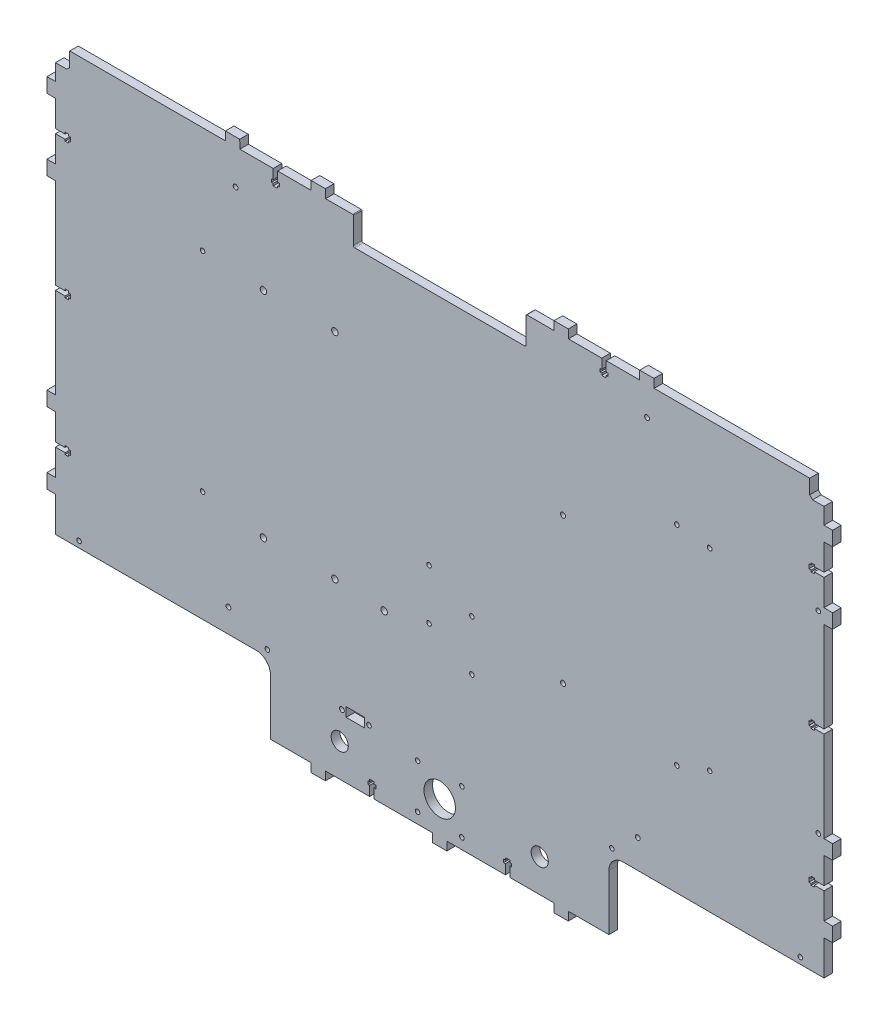
from build123d import *

# Parameters (mm, degrees)
SKETCH_1_R      = 1.6
SKETCH_1_R_2    = 1.7
SKETCH_1_R_3    = 6
SKETCH_1_W      = 13
SKETCH_1_H      = 6.5
SKETCH_1_R_4    = 1.626470027
SKETCH_1_R_5    = 2.25
SKETCH_1_R_6    = 11
SKETCH_1_R_7    = 1.75
EXTRUDE_1_DEPTH = 6


with BuildPart() as part:
    # Эскиз1 → Бобышка-Вытянуть1 (new body)
    with BuildSketch(Plane.XY):
        with BuildLine():
            Line((89.741925364, 539.042043616), (89.741925364, 500.137589553))
            Line((89.741925364, 500.137589553), (118.091925364, 500.137589553))
            Line((118.091925364, 500.137589553), (118.191925364, 494.137589553))
            Line((118.191925364, 494.137589553), (128.191925364, 494.137589553))
            Line((128.191925364, 494.137589553), (128.291925364, 500.137589553))
            Line((128.291925364, 500.137589553), (159.141925364, 500.137589553))
            Line((159.141925364, 500.137589553), (159.141925364, 506.937589553))
            Line((159.141925364, 506.937589553), (157.941925364, 506.937589553))
            Line((157.941925364, 506.937589553), (157.941925364, 509.137589553))
            Line((157.941925364, 509.137589553), (159.141925364, 509.137589553))
            Line((159.141925364, 509.137589553), (159.141925364, 510.637589553))
            Line((159.141925364, 510.637589553), (162.241925364, 510.637589553))
            Line((162.241925364, 510.637589553), (162.241925364, 509.137589553))
            Line((162.241925364, 509.137589553), (163.441925364, 509.137589553))
            Line((163.441925364, 509.137589553), (163.441925364, 506.937589553))
            Line((163.441925364, 506.937589553), (162.241925364, 506.937589553))
            Line((162.241925364, 506.937589553), (162.241925364, 500.137589553))
            Line((162.241925364, 500.137589553), (203.091925364, 500.137589553))
            Line((203.091925364, 500.137589553), (203.191925364, 494.137589553))
            Line((203.191925364, 494.137589553), (213.191925364, 494.137589553))
            Line((213.191925364, 494.137589553), (213.291925364, 500.137589553))
            Line((213.291925364, 500.137589553), (254.141925364, 500.137589553))
            Line((254.141925364, 500.137589553), (254.141925364, 506.937589553))
            Line((254.141925364, 506.937589553), (252.941925364, 506.937589553))
            Line((252.941925364, 506.937589553), (252.941925364, 509.137589553))
            Line((252.941925364, 509.137589553), (254.141925364, 509.137589553))
            Line((254.141925364, 509.137589553), (254.141925364, 510.637589553))
            Line((254.141925364, 510.637589553), (257.241925364, 510.637589553))
            Line((257.241925364, 510.637589553), (257.241925364, 509.137589553))
            Line((257.241925364, 509.137589553), (258.441925364, 509.137589553))
            Line((258.441925364, 509.137589553), (258.441925364, 506.937589553))
            Line((258.441925364, 506.937589553), (257.241925364, 506.937589553))
            Line((257.241925364, 506.937589553), (257.241925364, 500.137589553))
            Line((257.241925364, 500.137589553), (288.091925364, 500.137589553))
            Line((288.091925364, 500.137589553), (288.191925364, 494.137589553))
            Line((288.191925364, 494.137589553), (298.191925364, 494.137589553))
            Line((298.191925364, 494.137589553), (298.291925364, 500.137589553))
            Line((298.291925364, 500.137589553), (326.641925364, 500.137589553))
            Line((326.641925364, 500.137589553), (326.641925364, 539.137589553))
            ThreePointArc((326.641925364, 539.137589553), (329.570857552, 546.208657365), (336.641925364, 549.137589553))
            Line((336.641925364, 549.137589553), (377.191925364, 549.137589553))
            Line((377.191925364, 549.137589553), (477.191925364, 549.137589553))
            Line((477.191925364, 549.137589553), (477.191925364, 573.442043616))
            Line((477.191925364, 573.442043616), (483.191925364, 573.542043616))
            Line((483.191925364, 573.542043616), (483.191925364, 583.542043616))
            Line((483.191925364, 583.542043616), (477.191925364, 583.642043616))
            Line((477.191925364, 583.642043616), (477.191925364, 601.992043616))
            Line((477.191925364, 601.992043616), (470.391925364, 601.992043616))
            Line((470.391925364, 601.992043616), (470.391925364, 600.792043616))
            Line((470.391925364, 600.792043616), (468.191925364, 600.792043616))
            Line((468.191925364, 600.792043616), (468.191925364, 601.992043616))
            Line((468.191925364, 601.992043616), (466.691925364, 601.992043616))
            Line((466.691925364, 601.992043616), (466.691925364, 605.092043616))
            Line((466.691925364, 605.092043616), (468.191925364, 605.092043616))
            Line((468.191925364, 605.092043616), (468.191925364, 606.292043616))
            Line((468.191925364, 606.292043616), (470.391925364, 606.292043616))
            Line((470.391925364, 606.292043616), (470.391925364, 605.092043616))
            Line((470.391925364, 605.092043616), (477.191925364, 605.092043616))
            Line((477.191925364, 605.092043616), (477.191925364, 623.442043616))
            Line((477.191925364, 623.442043616), (483.191925364, 623.542043616))
            Line((483.191925364, 623.542043616), (483.191925364, 633.542043616))
            Line((483.191925364, 633.542043616), (477.191925364, 633.642043616))
            Line((477.191925364, 633.642043616), (477.191925364, 696.992043616))
            Line((477.191925364, 696.992043616), (470.391925364, 696.992043616))
            Line((470.391925364, 696.992043616), (470.391925364, 695.792043616))
            Line((470.391925364, 695.792043616), (468.191925364, 695.792043616))
            Line((468.191925364, 695.792043616), (468.191925364, 696.992043616))
            Line((468.191925364, 696.992043616), (466.691925364, 696.992043616))
            Line((466.691925364, 696.992043616), (466.691925364, 700.092043616))
            Line((466.691925364, 700.092043616), (468.191925364, 700.092043616))
            Line((468.191925364, 700.092043616), (468.191925364, 701.292043616))
            Line((468.191925364, 701.292043616), (470.391925364, 701.292043616))
            Line((470.391925364, 701.292043616), (470.391925364, 700.092043616))
            Line((470.391925364, 700.092043616), (477.191925364, 700.092043616))
            Line((477.191925364, 700.092043616), (477.191925364, 763.442043616))
            Line((477.191925364, 763.442043616), (483.191925364, 763.542043616))
            Line((483.191925364, 763.542043616), (483.191925364, 773.542043616))
            Line((483.191925364, 773.542043616), (477.191925364, 773.642043616))
            Line((477.191925364, 773.642043616), (477.191925364, 791.992043616))
            Line((477.191925364, 791.992043616), (470.391925364, 791.992043616))
            Line((470.391925364, 791.992043616), (470.391925364, 790.792043616))
            Line((470.391925364, 790.792043616), (468.191925364, 790.792043616))
            Line((468.191925364, 790.792043616), (468.191925364, 791.992043616))
            Line((468.191925364, 791.992043616), (466.691925364, 791.992043616))
            Line((466.691925364, 791.992043616), (466.691925364, 795.092043616))
            Line((466.691925364, 795.092043616), (468.191925364, 795.092043616))
            Line((468.191925364, 795.092043616), (468.191925364, 796.292043616))
            Line((468.191925364, 796.292043616), (470.391925364, 796.292043616))
            Line((470.391925364, 796.292043616), (470.391925364, 795.092043616))
            Line((470.391925364, 795.092043616), (477.191925364, 795.092043616))
            Line((477.191925364, 795.092043616), (477.191925364, 813.442043616))
            Line((477.191925364, 813.442043616), (483.191925364, 813.542043616))
            Line((483.191925364, 813.542043616), (483.191925364, 823.542043616))
            Line((483.191925364, 823.542043616), (477.191925364, 823.642043616))
            Line((477.191925364, 823.642043616), (477.191925364, 835.042043616))
            Line((477.191925364, 835.042043616), (469.191925364, 835.042043616))
            Line((469.191925364, 835.042043616), (467.191925364, 837.042043616))
            Line((467.191925364, 837.042043616), (467.191925364, 847.042043616))
            Line((467.191925364, 847.042043616), (467.191925364, 847.137589553))
            Line((467.191925364, 847.137589553), (367.191925364, 847.137589553))
            Line((367.191925364, 847.137589553), (358.291925364, 847.137589553))
            Line((358.291925364, 847.137589553), (358.191925364, 853.137589553))
            Line((358.191925364, 853.137589553), (348.191925364, 853.137589553))
            Line((348.191925364, 853.137589553), (348.091925364, 847.137589553))
            Line((348.091925364, 847.137589553), (324.741925364, 847.137589553))
            Line((324.741925364, 847.137589553), (324.741925364, 840.337589553))
            Line((324.741925364, 840.337589553), (325.941925364, 840.337589553))
            Line((325.941925364, 840.337589553), (325.941925364, 838.137589553))
            Line((325.941925364, 838.137589553), (324.741925364, 838.137589553))
            Line((324.741925364, 838.137589553), (324.741925364, 836.637589553))
            Line((324.741925364, 836.637589553), (321.641925364, 836.637589553))
            Line((321.641925364, 836.637589553), (321.641925364, 838.137589553))
            Line((321.641925364, 838.137589553), (320.441925364, 838.137589553))
            Line((320.441925364, 838.137589553), (320.441925364, 840.337589553))
            Line((320.441925364, 840.337589553), (321.641925364, 840.337589553))
            Line((321.641925364, 840.337589553), (321.641925364, 847.137589553))
            Line((321.641925364, 847.137589553), (298.291925364, 847.137589553))
            Line((298.291925364, 847.137589553), (298.191925364, 853.137589553))
            Line((298.191925364, 853.137589553), (288.191925364, 853.137589553))
            Line((288.191925364, 853.137589553), (288.091925364, 847.137589553))
            Line((288.091925364, 847.137589553), (269.191925364, 847.137589553))
            ThreePointArc((269.191925364, 847.137589553), (268.838371974, 846.991142943), (268.691925364, 846.637589553))
            Line((268.691925364, 846.637589553), (268.691925364, 828.542043616))
            ThreePointArc((268.691925364, 828.542043616), (268.399032145, 827.834936835), (267.691925364, 827.542043616))
            Line((267.691925364, 827.542043616), (148.691925364, 827.542043616))
            ThreePointArc((148.691925364, 827.542043616), (147.984818583, 827.834936835), (147.691925364, 828.542043616))
            Line((147.691925364, 828.542043616), (147.691925364, 846.542043616))
            Line((147.691925364, 846.542043616), (147.691925364, 846.637589553))
            ThreePointArc((147.691925364, 846.637589553), (147.545478755, 846.991142943), (147.191925364, 847.137589553))
            Line((147.191925364, 847.137589553), (128.291925364, 847.137589553))
            Line((128.291925364, 847.137589553), (128.191925364, 853.137589553))
            Line((128.191925364, 853.137589553), (118.191925364, 853.137589553))
            Line((118.191925364, 853.137589553), (118.091925364, 847.137589553))
            Line((118.091925364, 847.137589553), (94.741925364, 847.137589553))
            Line((94.741925364, 847.137589553), (94.741925364, 840.337589553))
            Line((94.741925364, 840.337589553), (95.941925364, 840.337589553))
            Line((95.941925364, 840.337589553), (95.941925364, 838.137589553))
            Line((95.941925364, 838.137589553), (94.741925364, 838.137589553))
            Line((94.741925364, 838.137589553), (94.741925364, 838.042043616))
            Line((94.741925364, 838.042043616), (94.741925364, 836.637589553))
            Line((94.741925364, 836.637589553), (94.741925364, 836.542043616))
            Line((94.741925364, 836.542043616), (91.641925364, 836.542043616))
            Line((91.641925364, 836.542043616), (91.641925364, 836.637589553))
            Line((91.641925364, 836.637589553), (91.641925364, 838.042043616))
            Line((91.641925364, 838.042043616), (91.641925364, 838.137589553))
            Line((91.641925364, 838.137589553), (90.441925364, 838.137589553))
            Line((90.441925364, 838.137589553), (90.441925364, 840.337589553))
            Line((90.441925364, 840.337589553), (91.641925364, 840.337589553))
            Line((91.641925364, 840.337589553), (91.641925364, 847.137589553))
            Line((91.641925364, 847.137589553), (68.291925364, 847.137589553))
            Line((68.291925364, 847.137589553), (68.191925364, 853.137589553))
            Line((68.191925364, 853.137589553), (58.191925364, 853.137589553))
            Line((58.191925364, 853.137589553), (58.091925364, 847.137589553))
            Line((58.091925364, 847.137589553), (49.191925364, 847.137589553))
            Line((49.191925364, 847.137589553), (-50.808074636, 847.137589553))
            Line((-50.808074636, 847.137589553), (-50.808074636, 847.042043616))
            Line((-50.808074636, 847.042043616), (-50.808074636, 837.042043616))
            Line((-50.808074636, 837.042043616), (-52.808074636, 835.042043616))
            Line((-52.808074636, 835.042043616), (-60.808074636, 835.042043616))
            Line((-60.808074636, 835.042043616), (-60.808074636, 823.642043616))
            Line((-60.808074636, 823.642043616), (-66.808074636, 823.542043616))
            Line((-66.808074636, 823.542043616), (-66.808074636, 813.542043616))
            Line((-66.808074636, 813.542043616), (-60.808074636, 813.442043616))
            Line((-60.808074636, 813.442043616), (-60.808074636, 795.092043616))
            Line((-60.808074636, 795.092043616), (-54.008074636, 795.092043616))
            Line((-54.008074636, 795.092043616), (-54.008074636, 796.292043616))
            Line((-54.008074636, 796.292043616), (-51.808074636, 796.292043616))
            Line((-51.808074636, 796.292043616), (-51.808074636, 795.092043616))
            Line((-51.808074636, 795.092043616), (-50.308074636, 795.092043616))
            Line((-50.308074636, 795.092043616), (-50.308074636, 791.992043616))
            Line((-50.308074636, 791.992043616), (-51.808074636, 791.992043616))
            Line((-51.808074636, 791.992043616), (-51.808074636, 790.792043616))
            Line((-51.808074636, 790.792043616), (-54.008074636, 790.792043616))
            Line((-54.008074636, 790.792043616), (-54.008074636, 791.992043616))
            Line((-54.008074636, 791.992043616), (-60.808074636, 791.992043616))
            Line((-60.808074636, 791.992043616), (-60.808074636, 773.642043616))
            Line((-60.808074636, 773.642043616), (-66.808074636, 773.542043616))
            Line((-66.808074636, 773.542043616), (-66.808074636, 763.542043616))
            Line((-66.808074636, 763.542043616), (-60.808074636, 763.442043616))
            Line((-60.808074636, 763.442043616), (-60.808074636, 700.092043616))
            Line((-60.808074636, 700.092043616), (-54.008074636, 700.092043616))
            Line((-54.008074636, 700.092043616), (-54.008074636, 701.292043616))
            Line((-54.008074636, 701.292043616), (-51.808074636, 701.292043616))
            Line((-51.808074636, 701.292043616), (-51.808074636, 700.092043616))
            Line((-51.808074636, 700.092043616), (-50.308074636, 700.092043616))
            Line((-50.308074636, 700.092043616), (-50.308074636, 696.992043616))
            Line((-50.308074636, 696.992043616), (-51.808074636, 696.992043616))
            Line((-51.808074636, 696.992043616), (-51.808074636, 695.792043616))
            Line((-51.808074636, 695.792043616), (-54.008074636, 695.792043616))
            Line((-54.008074636, 695.792043616), (-54.008074636, 696.992043616))
            Line((-54.008074636, 696.992043616), (-60.808074636, 696.992043616))
            Line((-60.808074636, 696.992043616), (-60.808074636, 633.642043616))
            Line((-60.808074636, 633.642043616), (-66.808074636, 633.542043616))
            Line((-66.808074636, 633.542043616), (-66.808074636, 623.542043616))
            Line((-66.808074636, 623.542043616), (-60.808074636, 623.442043616))
            Line((-60.808074636, 623.442043616), (-60.808074636, 605.092043616))
            Line((-60.808074636, 605.092043616), (-54.008074636, 605.092043616))
            Line((-54.008074636, 605.092043616), (-54.008074636, 606.292043616))
            Line((-54.008074636, 606.292043616), (-51.808074636, 606.292043616))
            Line((-51.808074636, 606.292043616), (-51.808074636, 605.092043616))
            Line((-51.808074636, 605.092043616), (-50.308074636, 605.092043616))
            Line((-50.308074636, 605.092043616), (-50.308074636, 601.992043616))
            Line((-50.308074636, 601.992043616), (-51.808074636, 601.992043616))
            Line((-51.808074636, 601.992043616), (-51.808074636, 600.792043616))
            Line((-51.808074636, 600.792043616), (-54.008074636, 600.792043616))
            Line((-54.008074636, 600.792043616), (-54.008074636, 601.992043616))
            Line((-54.008074636, 601.992043616), (-60.808074636, 601.992043616))
            Line((-60.808074636, 601.992043616), (-60.808074636, 583.642043616))
            Line((-60.808074636, 583.642043616), (-66.808074636, 583.542043616))
            Line((-66.808074636, 583.542043616), (-66.808074636, 573.542043616))
            Line((-66.808074636, 573.542043616), (-60.808074636, 573.442043616))
            Line((-60.808074636, 573.442043616), (-60.808074636, 549.042043616))
            Line((-60.808074636, 549.042043616), (39.191925364, 549.042043616))
            Line((39.191925364, 549.042043616), (79.741925364, 549.042043616))
            ThreePointArc((79.741925364, 549.042043616), (86.812993176, 546.113111428), (89.741925364, 539.042043616))
        make_face()
        with Locations((-44.258074636, 553.442043616)):
            Circle(SKETCH_1_R, mode=Mode.SUBTRACT)
        with Locations((60.306923435, 565.643369962)):
            Circle(SKETCH_1_R_2, mode=Mode.SUBTRACT)
        with Locations((138.191925364, 523.137589553)):
            Circle(SKETCH_1_R_3, mode=Mode.SUBTRACT)
        with Locations((192.691925364, 507.637589553)):
            Circle(SKETCH_1_R, mode=Mode.SUBTRACT)
        with Locations((192.691925364, 538.637589553)):
            Circle(SKETCH_1_R, mode=Mode.SUBTRACT)
        with Locations((87.541925364, 553.442043616)):
            Circle(SKETCH_1_R, mode=Mode.SUBTRACT)
        with Locations((139.700153258, 543.137589553)):
            Circle(SKETCH_1_R_2, mode=Mode.SUBTRACT)
        with Locations((149.200153258, 543.147589553)):
            Rectangle(SKETCH_1_W, SKETCH_1_H, mode=Mode.SUBTRACT)
        with Locations((158.700153258, 543.137589553)):
            Circle(SKETCH_1_R_4, mode=Mode.SUBTRACT)
        with Locations((42.191925364, 626.492043616)):
            Circle(SKETCH_1_R, mode=Mode.SUBTRACT)
        with Locations((84.78568386, 619.788752578)):
            Circle(SKETCH_1_R_5, mode=Mode.SUBTRACT)
        with Locations((134.78568386, 619.788752578)):
            Circle(SKETCH_1_R_5, mode=Mode.SUBTRACT)
        with Locations((169.28568386, 617.788752578)):
            Circle(SKETCH_1_R_5, mode=Mode.SUBTRACT)
        with Locations((200.717653837, 625.897847132)):
            Circle(SKETCH_1_R, mode=Mode.SUBTRACT)
        with Locations((200.717653837, 661.157846204)):
            Circle(SKETCH_1_R, mode=Mode.SUBTRACT)
        with Locations((223.691925364, 507.637589553)):
            Circle(SKETCH_1_R, mode=Mode.SUBTRACT)
        with Locations((208.191925364, 523.137589553)):
            Circle(SKETCH_1_R_6, mode=Mode.SUBTRACT)
        with Locations((223.691925364, 538.637589553)):
            Circle(SKETCH_1_R, mode=Mode.SUBTRACT)
        with Locations((278.191925364, 523.137589553)):
            Circle(SKETCH_1_R_3, mode=Mode.SUBTRACT)
        with Locations((328.741925364, 553.537589553)):
            Circle(SKETCH_1_R, mode=Mode.SUBTRACT)
        with Locations((346.784706522, 569.071596444)):
            Circle(SKETCH_1_R_2, mode=Mode.SUBTRACT)
        with Locations((460.641925364, 553.537589553)):
            Circle(SKETCH_1_R, mode=Mode.SUBTRACT)
        with Locations((230.717653837, 609.897847132)):
            Circle(SKETCH_1_R, mode=Mode.SUBTRACT)
        with Locations((230.717653837, 645.157846204)):
            Circle(SKETCH_1_R, mode=Mode.SUBTRACT)
        with Locations((294.485262853, 636.368280179)):
            Circle(SKETCH_1_R_7, mode=Mode.SUBTRACT)
        with Locations((374.191925364, 626.492043616)):
            Circle(SKETCH_1_R, mode=Mode.SUBTRACT)
        with Locations((397.191925363, 634.750548648)):
            Circle(SKETCH_1_R, mode=Mode.SUBTRACT)
        with Locations((473.191925363, 634.750548648)):
            Circle(SKETCH_1_R, mode=Mode.SUBTRACT)
        with Locations((42.191925364, 772.492043616)):
            Circle(SKETCH_1_R, mode=Mode.SUBTRACT)
        with Locations((65.280069026, 822.688709986)):
            Circle(SKETCH_1_R_2, mode=Mode.SUBTRACT)
        with Locations((84.78568386, 769.788752578)):
            Circle(SKETCH_1_R_5, mode=Mode.SUBTRACT)
        with Locations((134.78568386, 769.788752578)):
            Circle(SKETCH_1_R_5, mode=Mode.SUBTRACT)
        with Locations((294.485262853, 738.368280179)):
            Circle(SKETCH_1_R_7, mode=Mode.SUBTRACT)
        with Locations((374.191925364, 772.492043616)):
            Circle(SKETCH_1_R, mode=Mode.SUBTRACT)
        with Locations((397.191925363, 769.750548648)):
            Circle(SKETCH_1_R, mode=Mode.SUBTRACT)
        with Locations((473.191925363, 769.750548648)):
            Circle(SKETCH_1_R, mode=Mode.SUBTRACT)
        with Locations((353.343052835, 826.939418984)):
            Circle(SKETCH_1_R_2, mode=Mode.SUBTRACT)
    extrude(amount=EXTRUDE_1_DEPTH)


solid = part.part
